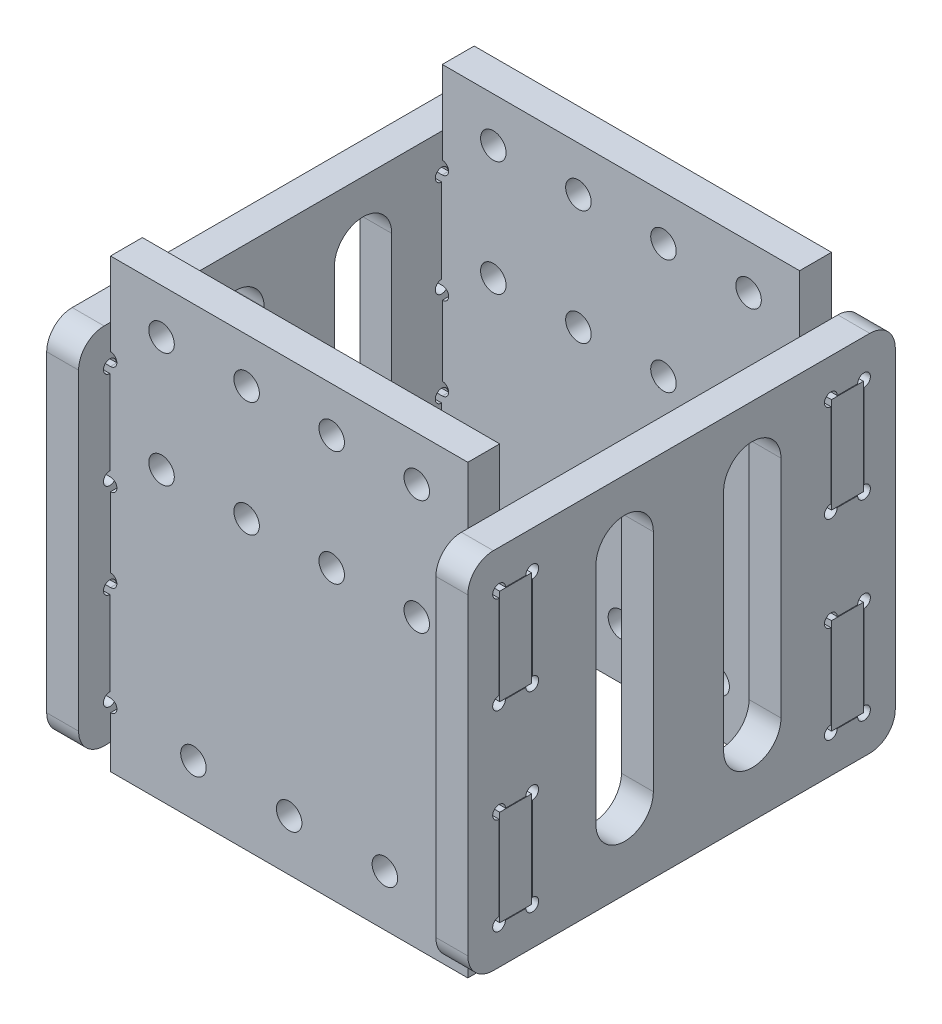
from build123d import *

# Parameters (mm, degrees)
SKETCH_1_R             = 2
EXTRUDE_1_DEPTH        = 5
PATTERN_LINEAR_1_COUNT = 2
PATTERN_LINEAR_1_PITCH = 52
SKETCH_2_W             = 67
SKETCH_2_H             = 57
EXTRUDE_2_DEPTH        = 5
FILLET_1_R             = 4
CUT_EXTRUDE_1_DEPTH    = 5
PATTERN_LINEAR_2_COUNT = 2
PATTERN_LINEAR_2_PITCH = 61


with BuildPart() as part:
    # 草图1 → 凸台-拉伸1 (new body)
    with BuildSketch(Plane.XY):
        with BuildLine():
            Line((28, 22), (28, 35))
            Line((28, 35), (-28, 35))
            Line((-28, 35), (-28, 22))
            ThreePointArc((-28, 22), (-27, 21), (-28, 20))
            Line((-28, 20), (-33, 20))
            Line((-33, 20), (-33, 5))
            Line((-33, 5), (-28, 5))
            ThreePointArc((-28, 5), (-27, 4), (-28, 3))
            Line((-28, 3), (-28, -8))
            ThreePointArc((-28, -8), (-27, -9), (-28, -10))
            Line((-28, -10), (-33, -10))
            Line((-33, -10), (-33, -25))
            Line((-33, -25), (-28, -25))
            ThreePointArc((-28, -25), (-27, -26), (-28, -27))
            Line((-28, -27), (-28, -35))
            Line((-28, -35), (28, -35))
            Line((28, -35), (28, -27))
            ThreePointArc((28, -27), (27, -26), (28, -25))
            Line((28, -25), (33, -25))
            Line((33, -25), (33, -10))
            Line((33, -10), (28, -10))
            ThreePointArc((28, -10), (27, -9), (28, -8))
            Line((28, -8), (28, 3))
            ThreePointArc((28, 3), (27, 4), (28, 5))
            Line((28, 5), (33, 5))
            Line((33, 5), (33, 20))
            Line((33, 20), (28, 20))
            ThreePointArc((28, 20), (27, 21), (28, 22))
        make_face()
        with Locations((-15, -27)):
            Circle(SKETCH_1_R, mode=Mode.SUBTRACT)
        with Locations((0, -27)):
            Circle(SKETCH_1_R, mode=Mode.SUBTRACT)
        with Locations((15, -27)):
            Circle(SKETCH_1_R, mode=Mode.SUBTRACT)
        with Locations((-20, 10)):
            Circle(SKETCH_1_R, mode=Mode.SUBTRACT)
        with Locations((-6.666666667, 10)):
            Circle(SKETCH_1_R, mode=Mode.SUBTRACT)
        with Locations((-20, 28)):
            Circle(SKETCH_1_R, mode=Mode.SUBTRACT)
        with Locations((-6.666666667, 28)):
            Circle(SKETCH_1_R, mode=Mode.SUBTRACT)
        with Locations((6.666666667, 10)):
            Circle(SKETCH_1_R, mode=Mode.SUBTRACT)
        with Locations((20, 10)):
            Circle(SKETCH_1_R, mode=Mode.SUBTRACT)
        with Locations((6.666666667, 28)):
            Circle(SKETCH_1_R, mode=Mode.SUBTRACT)
        with Locations((20, 28)):
            Circle(SKETCH_1_R, mode=Mode.SUBTRACT)
    extrude(amount=EXTRUDE_1_DEPTH)


with BuildPart() as pattern_linear_1_1:
    # 阵列(线性)1: pattern copy
    add(part.part.moved(Location(Vector(0, 0, -1) * (1 * PATTERN_LINEAR_1_PITCH))))


with BuildPart() as body_3:
    # 草图2 → 凸台-拉伸2 (new body)
    with BuildSketch(Plane.ZY.offset(33)):
        with Locations((-23.5, -2.5)):
            Rectangle(SKETCH_2_W, SKETCH_2_H)
        with BuildLine():
            Line((-52.1, 19.1), (-52.1, 5.9))
            ThreePointArc((-52.1, 5.9), (-52.807106781, 4.192893219), (-51.1, 4.9))
            Line((-51.1, 4.9), (-47.9, 4.9))
            ThreePointArc((-47.9, 4.9), (-46.192893219, 4.192893219), (-46.9, 5.9))
            Line((-46.9, 5.9), (-46.9, 19.1))
            ThreePointArc((-46.9, 19.1), (-46.192893219, 20.807106781), (-47.9, 20.1))
            Line((-47.9, 20.1), (-51.1, 20.1))
            ThreePointArc((-51.1, 20.1), (-52.807106781, 20.807106781), (-52.1, 19.1))
        make_face(mode=Mode.SUBTRACT)
        with BuildLine():
            Line((-0.1, 19.1), (-0.1, 5.9))
            ThreePointArc((-0.1, 5.9), (-0.807106781, 4.192893219), (0.9, 4.9))
            Line((0.9, 4.9), (4.1, 4.9))
            ThreePointArc((4.1, 4.9), (5.807106781, 4.192893219), (5.1, 5.9))
            Line((5.1, 5.9), (5.1, 19.1))
            ThreePointArc((5.1, 19.1), (5.807106781, 20.807106781), (4.1, 20.1))
            Line((4.1, 20.1), (0.9, 20.1))
            ThreePointArc((0.9, 20.1), (-0.807106781, 20.807106781), (-0.1, 19.1))
        make_face(mode=Mode.SUBTRACT)
        with BuildLine():
            Line((-0.1, -10.9), (-0.1, -24.1))
            ThreePointArc((-0.1, -24.1), (-0.807106781, -25.807106781), (0.9, -25.1))
            Line((0.9, -25.1), (4.1, -25.1))
            ThreePointArc((4.1, -25.1), (5.807106781, -25.807106781), (5.1, -24.1))
            Line((5.1, -24.1), (5.1, -10.9))
            ThreePointArc((5.1, -10.9), (5.807106781, -9.192893219), (4.1, -9.9))
            Line((4.1, -9.9), (0.9, -9.9))
            ThreePointArc((0.9, -9.9), (-0.807106781, -9.192893219), (-0.1, -10.9))
        make_face(mode=Mode.SUBTRACT)
        with BuildLine():
            Line((-52.1, -10.9), (-52.1, -24.1))
            ThreePointArc((-52.1, -24.1), (-52.807106781, -25.807106781), (-51.1, -25.1))
            Line((-51.1, -25.1), (-47.9, -25.1))
            ThreePointArc((-47.9, -25.1), (-46.192893219, -25.807106781), (-46.9, -24.1))
            Line((-46.9, -24.1), (-46.9, -10.9))
            ThreePointArc((-46.9, -10.9), (-46.192893219, -9.192893219), (-47.9, -9.9))
            Line((-47.9, -9.9), (-51.1, -9.9))
            ThreePointArc((-51.1, -9.9), (-52.807106781, -9.192893219), (-52.1, -10.9))
        make_face(mode=Mode.SUBTRACT)
    extrude(amount=-EXTRUDE_2_DEPTH)

    # 圆角1
    fillet_1_edges = [body_3.edges().sort_by_distance(p)[0] for p in [
        (-30.5, 26, -57),
        (-30.5, 26, 10),
        (-30.5, -31, 10),
        (-30.5, -31, -57),
    ]]
    fillet(fillet_1_edges, radius=FILLET_1_R)

    # 草图3 → 切除-拉伸1 (cut)
    with BuildSketch(Plane.ZY.offset(33)):
        with BuildLine():
            Line((-30.090355353, 16.026545973), (-30.090355353, -19.246833248))
            ThreePointArc((-30.090355353, -19.246833248), (-34.583779458, -23.740257352), (-39.077203562, -19.246833248))
            Line((-39.077203562, -19.246833248), (-39.077203562, 16.026545973))
            ThreePointArc((-39.077203562, 16.026545973), (-34.583779458, 20.519970077), (-30.090355353, 16.026545973))
        make_face()
        with BuildLine():
            Line((-10.090355353, 16.026545973), (-10.090355353, -19.246833248))
            ThreePointArc((-10.090355353, -19.246833248), (-14.583779458, -23.740257352), (-19.077203562, -19.246833248))
            Line((-19.077203562, -19.246833248), (-19.077203562, 16.026545973))
            ThreePointArc((-19.077203562, 16.026545973), (-14.583779458, 20.519970077), (-10.090355353, 16.026545973))
        make_face()
    extrude(amount=-CUT_EXTRUDE_1_DEPTH, mode=Mode.SUBTRACT)


with BuildPart() as pattern_linear_2_1:
    # 阵列(线性)2: pattern copy
    add(body_3.part.moved(Location(Vector(1, 0, 0) * (1 * PATTERN_LINEAR_2_PITCH))))


solid = Compound([part.part, pattern_linear_1_1.part, body_3.part, pattern_linear_2_1.part])
